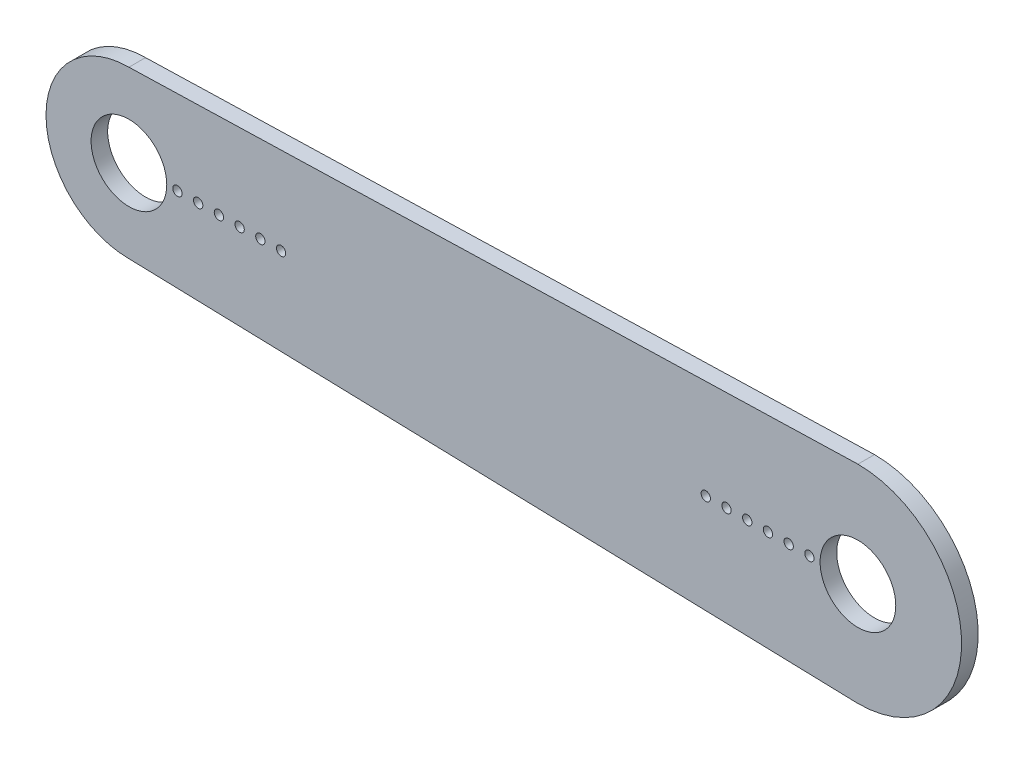
from build123d import *

# Parameters (mm, degrees)
ESBO_O1_R                = 3.65
RESSALTO_EXTRUS_O1_DEPTH = 1.6
CORTE_EXTRUS_O2_REACH    = 80.982
ESBO_O3_R                = 0.45


with BuildPart() as part:
    # Esboço1 → Ressalto-extrusão1 (new body)
    with BuildSketch(Plane.XY):
        with BuildLine():
            Line((-0.568287769, 9.983839392), (-70.33, 8))
            ThreePointArc((-70.33, 8), (-78.33, 0), (-70.33, -8))
            Line((-70.33, -8), (-0.568287769, -9.983839392))
            Line((-0.568287769, -9.983839392), (0, -10))
            ThreePointArc((0, -10), (10, 0), (0, 10))
            Line((0, 10), (-0.568287769, 9.983839392))
        make_face()
        with Locations((-70.33, 0)):
            Circle(ESBO_O1_R, mode=Mode.SUBTRACT)
        Circle(ESBO_O1_R, mode=Mode.SUBTRACT)
    extrude(amount=RESSALTO_EXTRUS_O1_DEPTH)

    # Esboço3 → Corte-extrusão2 (cut, up to next)
    with BuildSketch(Plane.XY.offset(1.6), mode=Mode.PRIVATE) as corte_extrus_o2_sk1:
        with Locations((-65.65, 0)):
            Circle(ESBO_O3_R)
    corte_extrus_o2_tool1 = extrude(corte_extrus_o2_sk1.sketch, amount=-CORTE_EXTRUS_O2_REACH, mode=Mode.PRIVATE) & part.part
    # Esboço3 → Corte-extrusão2 (cut, up to next)
    with BuildSketch(Plane.XY.offset(1.6), mode=Mode.PRIVATE) as corte_extrus_o2_sk2:
        with Locations((-4.68, 0)):
            Circle(ESBO_O3_R)
    corte_extrus_o2_tool2 = extrude(corte_extrus_o2_sk2.sketch, amount=-CORTE_EXTRUS_O2_REACH, mode=Mode.PRIVATE) & part.part
    # Esboço3 → Corte-extrusão2 (cut, up to next)
    with BuildSketch(Plane.XY.offset(1.6), mode=Mode.PRIVATE) as corte_extrus_o2_sk3:
        with Locations((-6.68, 0)):
            Circle(ESBO_O3_R)
    corte_extrus_o2_tool3 = extrude(corte_extrus_o2_sk3.sketch, amount=-CORTE_EXTRUS_O2_REACH, mode=Mode.PRIVATE) & part.part
    # Esboço3 → Corte-extrusão2 (cut, up to next)
    with BuildSketch(Plane.XY.offset(1.6), mode=Mode.PRIVATE) as corte_extrus_o2_sk4:
        with Locations((-8.68, 0)):
            Circle(ESBO_O3_R)
    corte_extrus_o2_tool4 = extrude(corte_extrus_o2_sk4.sketch, amount=-CORTE_EXTRUS_O2_REACH, mode=Mode.PRIVATE) & part.part
    # Esboço3 → Corte-extrusão2 (cut, up to next)
    with BuildSketch(Plane.XY.offset(1.6), mode=Mode.PRIVATE) as corte_extrus_o2_sk5:
        with Locations((-10.68, 0)):
            Circle(ESBO_O3_R)
    corte_extrus_o2_tool5 = extrude(corte_extrus_o2_sk5.sketch, amount=-CORTE_EXTRUS_O2_REACH, mode=Mode.PRIVATE) & part.part
    # Esboço3 → Corte-extrusão2 (cut, up to next)
    with BuildSketch(Plane.XY.offset(1.6), mode=Mode.PRIVATE) as corte_extrus_o2_sk6:
        with Locations((-12.68, 0)):
            Circle(ESBO_O3_R)
    corte_extrus_o2_tool6 = extrude(corte_extrus_o2_sk6.sketch, amount=-CORTE_EXTRUS_O2_REACH, mode=Mode.PRIVATE) & part.part
    # Esboço3 → Corte-extrusão2 (cut, up to next)
    with BuildSketch(Plane.XY.offset(1.6), mode=Mode.PRIVATE) as corte_extrus_o2_sk7:
        with Locations((-14.68, 0)):
            Circle(ESBO_O3_R)
    corte_extrus_o2_tool7 = extrude(corte_extrus_o2_sk7.sketch, amount=-CORTE_EXTRUS_O2_REACH, mode=Mode.PRIVATE) & part.part
    # Esboço3 → Corte-extrusão2 (cut, up to next)
    with BuildSketch(Plane.XY.offset(1.6), mode=Mode.PRIVATE) as corte_extrus_o2_sk8:
        with Locations((-63.65, 0)):
            Circle(ESBO_O3_R)
    corte_extrus_o2_tool8 = extrude(corte_extrus_o2_sk8.sketch, amount=-CORTE_EXTRUS_O2_REACH, mode=Mode.PRIVATE) & part.part
    # Esboço3 → Corte-extrusão2 (cut, up to next)
    with BuildSketch(Plane.XY.offset(1.6), mode=Mode.PRIVATE) as corte_extrus_o2_sk9:
        with Locations((-61.65, 0)):
            Circle(ESBO_O3_R)
    corte_extrus_o2_tool9 = extrude(corte_extrus_o2_sk9.sketch, amount=-CORTE_EXTRUS_O2_REACH, mode=Mode.PRIVATE) & part.part
    # Esboço3 → Corte-extrusão2 (cut, up to next)
    with BuildSketch(Plane.XY.offset(1.6), mode=Mode.PRIVATE) as corte_extrus_o2_sk10:
        with Locations((-59.65, 0)):
            Circle(ESBO_O3_R)
    corte_extrus_o2_tool10 = extrude(corte_extrus_o2_sk10.sketch, amount=-CORTE_EXTRUS_O2_REACH, mode=Mode.PRIVATE) & part.part
    # Esboço3 → Corte-extrusão2 (cut, up to next)
    with BuildSketch(Plane.XY.offset(1.6), mode=Mode.PRIVATE) as corte_extrus_o2_sk11:
        with Locations((-57.65, 0)):
            Circle(ESBO_O3_R)
    corte_extrus_o2_tool11 = extrude(corte_extrus_o2_sk11.sketch, amount=-CORTE_EXTRUS_O2_REACH, mode=Mode.PRIVATE) & part.part
    # Esboço3 → Corte-extrusão2 (cut, up to next)
    with BuildSketch(Plane.XY.offset(1.6), mode=Mode.PRIVATE) as corte_extrus_o2_sk12:
        with Locations((-55.65, 0)):
            Circle(ESBO_O3_R)
    corte_extrus_o2_tool12 = extrude(corte_extrus_o2_sk12.sketch, amount=-CORTE_EXTRUS_O2_REACH, mode=Mode.PRIVATE) & part.part
    add(corte_extrus_o2_tool1.solids().sort_by_distance((-65.65, 0, 1.6))[0], mode=Mode.SUBTRACT)
    add(corte_extrus_o2_tool2.solids().sort_by_distance((-4.68, 0, 1.6))[0], mode=Mode.SUBTRACT)
    add(corte_extrus_o2_tool3.solids().sort_by_distance((-6.68, 0, 1.6))[0], mode=Mode.SUBTRACT)
    add(corte_extrus_o2_tool4.solids().sort_by_distance((-8.68, 0, 1.6))[0], mode=Mode.SUBTRACT)
    add(corte_extrus_o2_tool5.solids().sort_by_distance((-10.68, 0, 1.6))[0], mode=Mode.SUBTRACT)
    add(corte_extrus_o2_tool6.solids().sort_by_distance((-12.68, 0, 1.6))[0], mode=Mode.SUBTRACT)
    add(corte_extrus_o2_tool7.solids().sort_by_distance((-14.68, 0, 1.6))[0], mode=Mode.SUBTRACT)
    add(corte_extrus_o2_tool8.solids().sort_by_distance((-63.65, 0, 1.6))[0], mode=Mode.SUBTRACT)
    add(corte_extrus_o2_tool9.solids().sort_by_distance((-61.65, 0, 1.6))[0], mode=Mode.SUBTRACT)
    add(corte_extrus_o2_tool10.solids().sort_by_distance((-59.65, 0, 1.6))[0], mode=Mode.SUBTRACT)
    add(corte_extrus_o2_tool11.solids().sort_by_distance((-57.65, 0, 1.6))[0], mode=Mode.SUBTRACT)
    add(corte_extrus_o2_tool12.solids().sort_by_distance((-55.65, 0, 1.6))[0], mode=Mode.SUBTRACT)


solid = part.part
